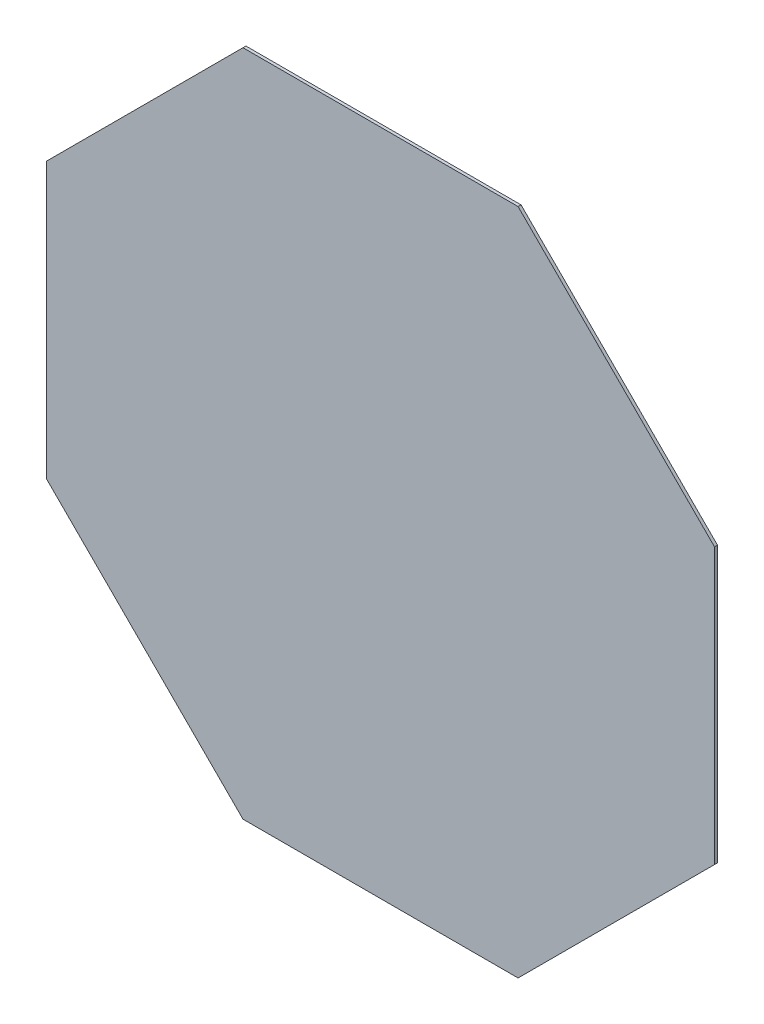
from build123d import *

# Parameters (mm, degrees)
ESBO_O1_W                = 680
ESBO_O1_H                = 680
RESSALTO_EXTRUS_O1_DEPTH = 3
CHANFRO1_SIZE            = 200


with BuildPart() as part:
    # Esboço1 → Ressalto-extrusão1 (new body)
    with BuildSketch(Plane.XY):
        with Locations((340, 340)):
            Rectangle(ESBO_O1_W, ESBO_O1_H)
    extrude(amount=RESSALTO_EXTRUS_O1_DEPTH)

    # Chanfro1
    chanfro1_edges = [part.edges().sort_by_distance(p)[0] for p in [
        (0, 0, 1.5),
        (0, 680, 1.5),
        (680, 680, 1.5),
        (680, 0, 1.5),
    ]]
    chamfer(chanfro1_edges, length=CHANFRO1_SIZE)


solid = part.part
